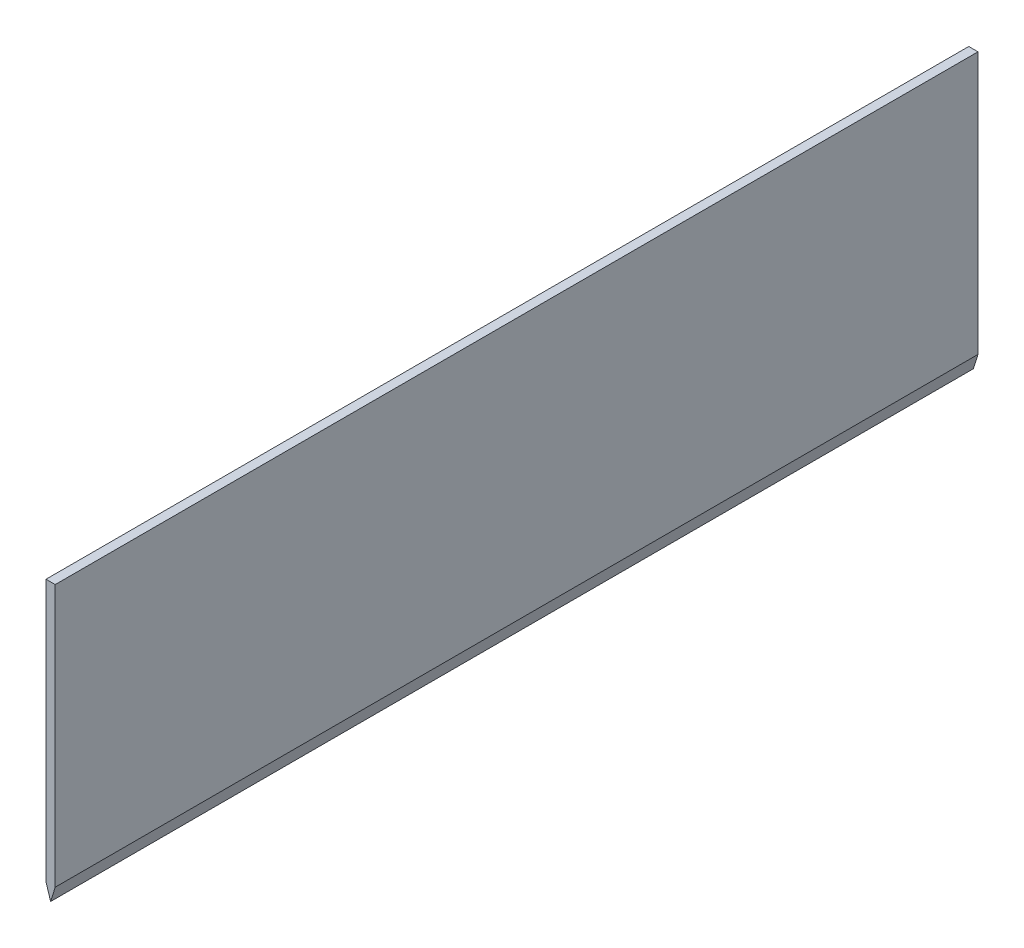
from build123d import *

# Parameters (mm, degrees)
SALIENTE_EXTRUIR1_DEPTH = 50


with BuildPart() as part:
    # Croquis1 → Saliente-Extruir1 (new, symmetric)
    with BuildSketch(Plane.XY):
        Polygon((0, -15), (0.5, -13.402366253), (0.5, 15), (-0.5, 15), (-0.5, -13.402366253), align=None)
    extrude(amount=SALIENTE_EXTRUIR1_DEPTH, both=True)


solid = part.part
